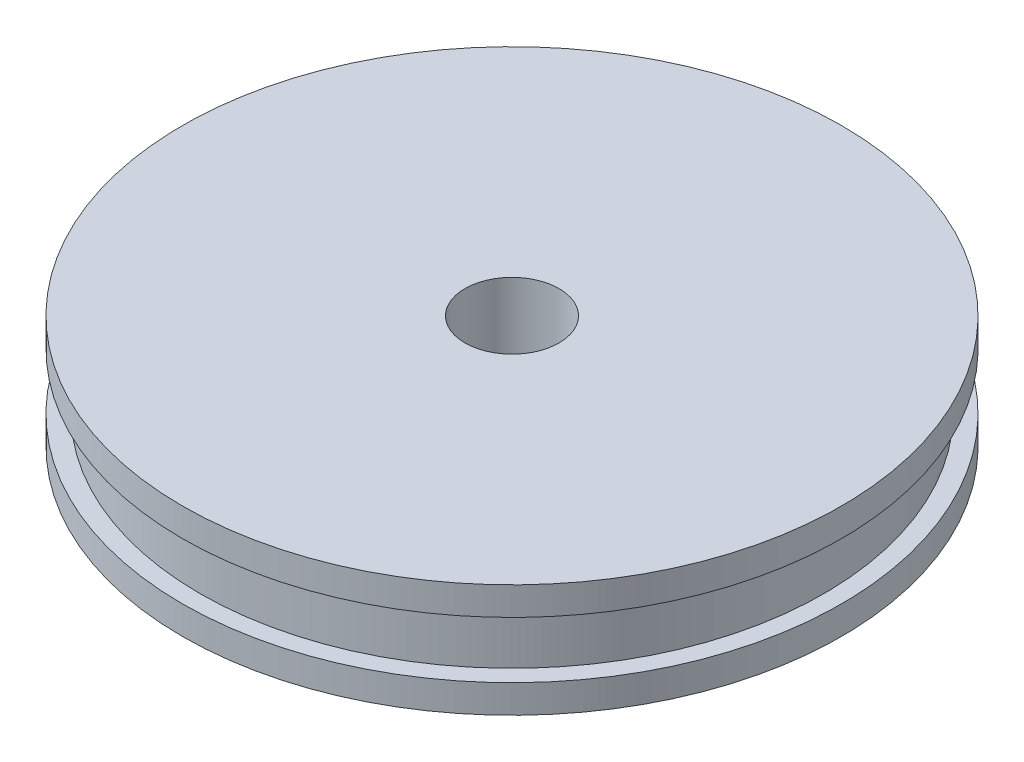
from build123d import *

# Parameters (mm, degrees)
SKETCH1_R           = 35
SKETCH1_R_2         = 5
BOSS_EXTRUDE1_DEPTH = 12
SKETCH2_W           = 1.873405934
SKETCH2_H           = 6


with BuildPart() as part:
    # Sketch1 → Boss-Extrude1 (new body)
    with BuildSketch(Plane(origin=(0, 0, 0), x_dir=(1, 0, 0), z_dir=(0, 1, 0))):
        with Locations(Location((0, 0, 0), (0, 0, 270))):
            Circle(SKETCH1_R)
        with Locations(Location((0, 0, 0), (0, 0, 270))):
            Circle(SKETCH1_R_2, mode=Mode.SUBTRACT)
    extrude(amount=BOSS_EXTRUDE1_DEPTH)

    # Sketch2 → Cut-Revolve1 (revolve, cut)
    with BuildSketch(Plane.XY, mode=Mode.PRIVATE) as cut_revolve1_sk:
        with Locations((-34.063297033, 6)):
            Rectangle(SKETCH2_W, SKETCH2_H)
    revolve(cut_revolve1_sk.sketch.rotate(Axis((0, 28.885066711, 0), (0, -1, 0)), 270), axis=Axis((0, 28.885066711, 0), (0, -1, 0)), mode=Mode.SUBTRACT)


solid = part.part
